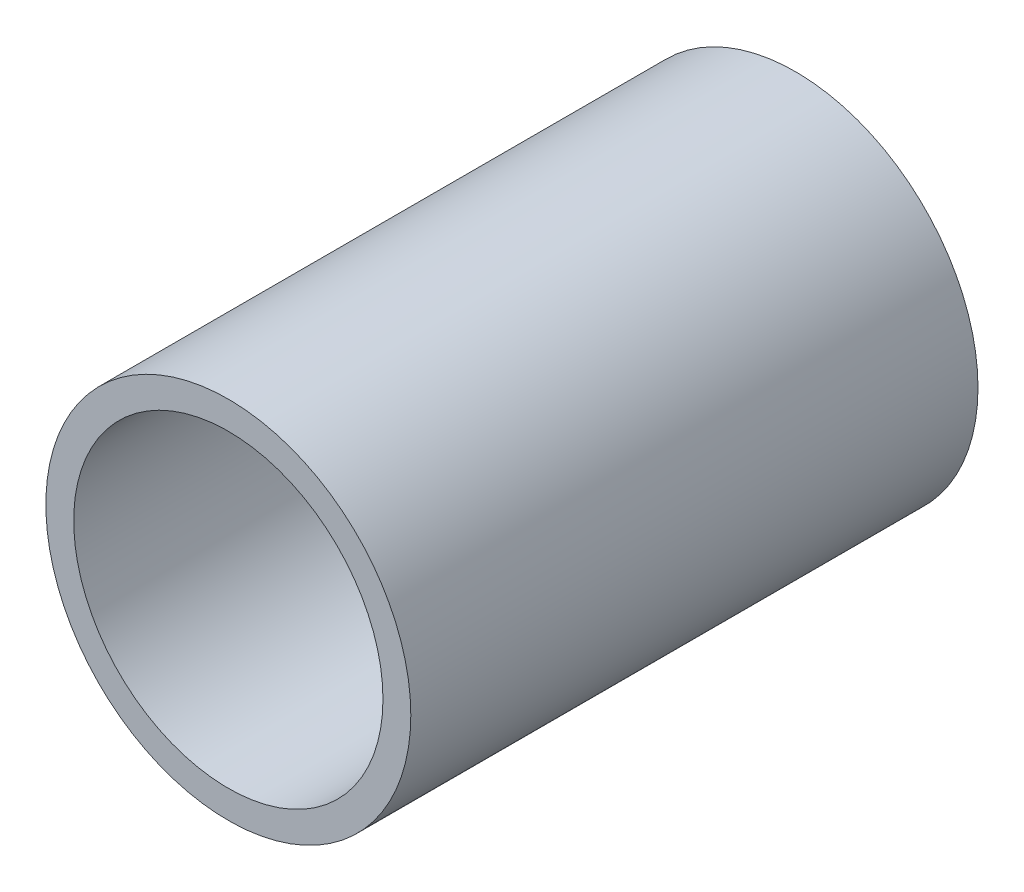
from build123d import *

# Parameters (mm, degrees)
CROQUIS2_R              = 24.13
CROQUIS2_R_2            = 20.447
SALIENTE_EXTRUIR1_DEPTH = 37.5


with BuildPart() as part:
    # Croquis2 → Saliente-Extruir1 (new, symmetric)
    with BuildSketch(Plane.XY):
        Circle(CROQUIS2_R)
        Circle(CROQUIS2_R_2, mode=Mode.SUBTRACT)
    extrude(amount=SALIENTE_EXTRUIR1_DEPTH, both=True)


solid = part.part
